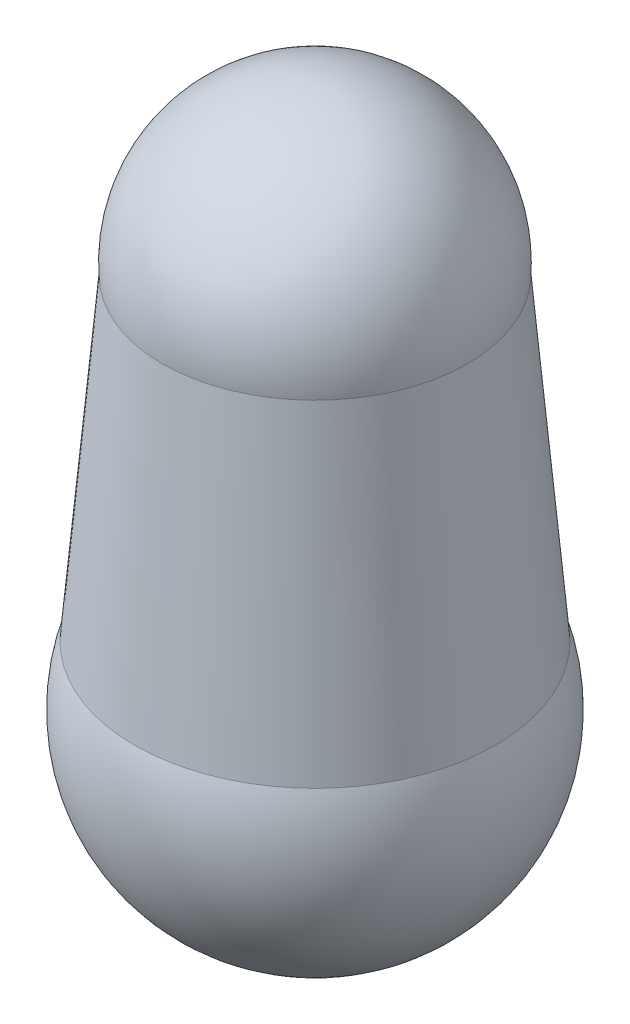
from build123d import *

# Parameters (mm, degrees)
SKETCH2_R           = 4.788935917
BOSS_EXTRUDE1_DEPTH = 10
BOSS_EXTRUDE1_TAPER = 5


with BuildPart() as part:
    # Sketch1 → Revolve1 (revolve)
    with BuildSketch(Plane(origin=(0, 0, 0), x_dir=(1, 0, 0), z_dir=(0, 1, 0))):
        with BuildLine():
            Line((0, 4.9), (0, -4.9))
            ThreePointArc((0, -4.9), (4.9, 0), (0, 4.9))
        make_face()
    revolve(axis=Axis((0, 0, -4.9), (0, 0, 1)))

    # Sketch2 → Boss-Extrude1 (add)
    with BuildSketch(Plane(origin=(0, 0, 0), x_dir=(1, 0, 0), z_dir=(0, 1, 0))):
        Circle(SKETCH2_R)
    extrude(amount=BOSS_EXTRUDE1_DEPTH, taper=BOSS_EXTRUDE1_TAPER)

    # Sketch3 → Revolve2 (revolve)
    with BuildSketch(Plane(origin=(0, 10, 0), x_dir=(1, 0, 0), z_dir=(0, 1, 0))):
        with BuildLine():
            Line((0, 3.951401393), (0, -3.951401393))
            ThreePointArc((0, -3.951401393), (3.951401393, 0), (0, 3.951401393))
        make_face()
    revolve(axis=Axis((0, 10, -3.951401393), (0, 0, 1)))


solid = part.part
